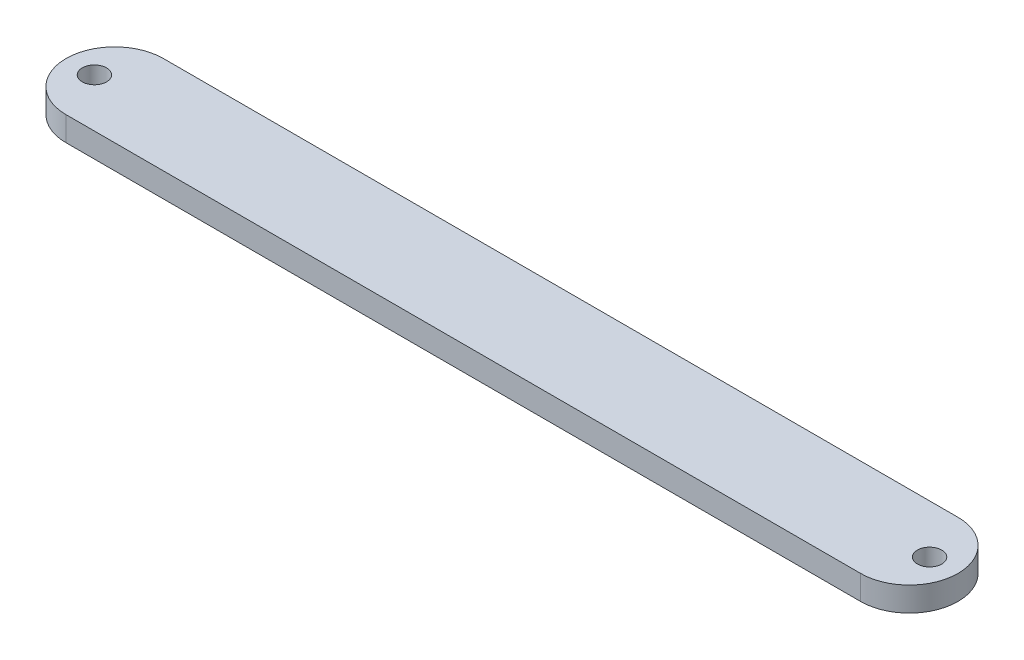
from build123d import *

# Parameters (mm, degrees)
SKETCH1_R           = 1.5
BOSS_EXTRUDE1_DEPTH = 3


with BuildPart() as part:
    # Sketch1 → Boss-Extrude1 (new body)
    with BuildSketch(Plane(origin=(0, 0, 0), x_dir=(1, 0, 0), z_dir=(0, 1, 0))):
        with BuildLine():
            Line((-49, 6), (49, 6))
            ThreePointArc((49, 6), (55, 0), (49, -6))
            Line((49, -6), (-49, -6))
            ThreePointArc((-49, -6), (-55, 0), (-49, 6))
        make_face()
        with Locations(Location((-51.5, 0, 0), (0, 0, 270))):
            Circle(SKETCH1_R, mode=Mode.SUBTRACT)
        with Locations(Location((51.5, 0, 0), (0, 0, 270))):
            Circle(SKETCH1_R, mode=Mode.SUBTRACT)
    extrude(amount=BOSS_EXTRUDE1_DEPTH)


solid = part.part
